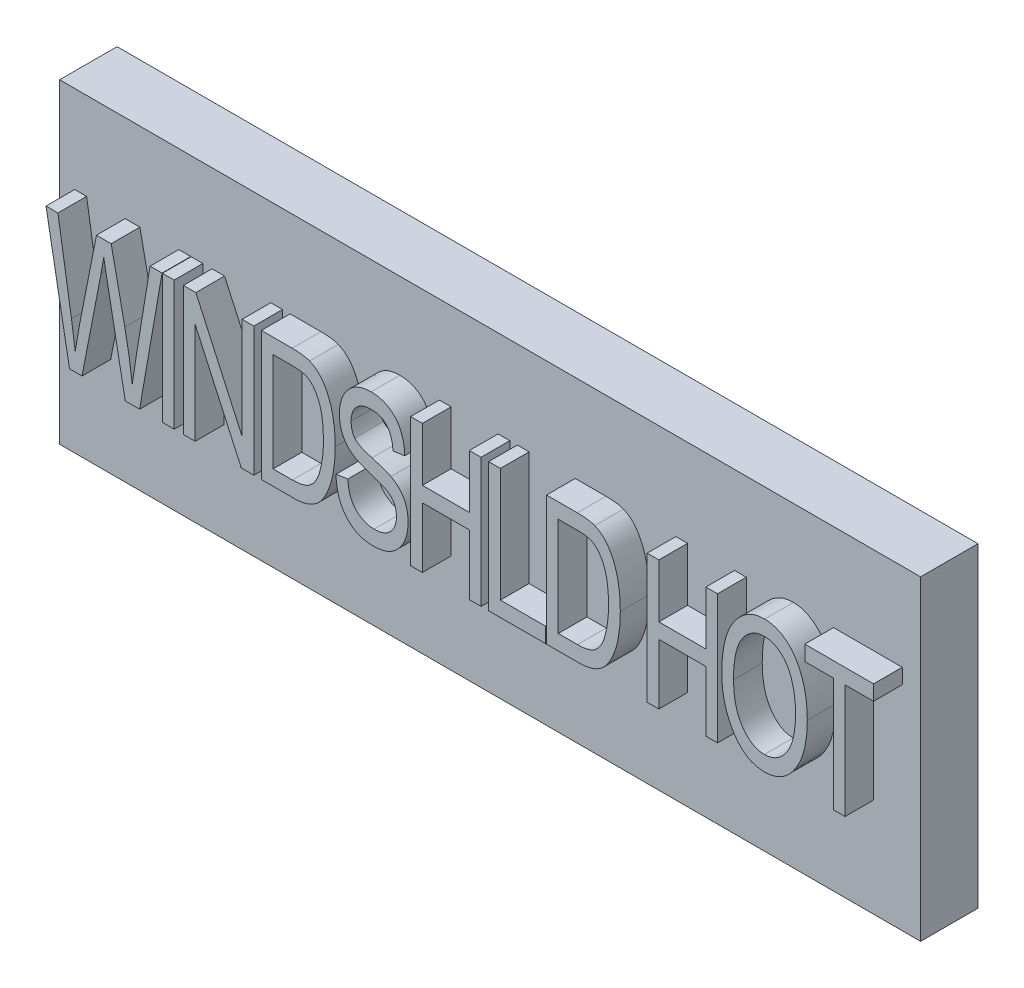
from build123d import *

# Parameters (mm, degrees)
SKETCH1_W           = 30
SKETCH1_H           = 11
BOSS_EXTRUDE1_DEPTH = 2
SKETCH2_W           = 0.409090909
SKETCH2_H           = 4.5
BOSS_EXTRUDE2_DEPTH = 1


with BuildPart() as part:
    # Sketch1 → Boss-Extrude1 (new body)
    with BuildSketch(Plane.XY):
        with Locations((-36.24, 26.08)):
            Rectangle(SKETCH1_W, SKETCH1_H)
    extrude(amount=BOSS_EXTRUDE1_DEPTH)

    # Sketch2 → Boss-Extrude2 (add)
    # profile 1 of 11: a face of its own
    with BuildSketch(Plane.XY.offset(2)):
        with BuildLine():
            Line((-49.896598041, 24.031303977), (-50.715693009, 28.531303977))
            Line((-50.715693009, 28.531303977), (-50.300210054, 28.531303977))
            Line((-50.300210054, 28.531303977), (-49.829024989, 25.580918425))
            add(Edge.make_bspline(
                [(-49.829024989, 25.580918425), (-49.804767081, 25.428844125), (-49.755939345, 25.122740092), (-49.717083509, 24.815210797), (-49.697531483, 24.660463879)],
                knots=[0, 0, 0, 0, 0.993611861, 2, 2, 2, 2], degree=3))
            Line((-49.697531483, 24.660463879), (-49.555993333, 25.492342938))
            Line((-49.555993333, 25.492342938), (-48.956967359, 28.531303977))
            Line((-48.956967359, 28.531303977), (-48.444690574, 28.531303977))
            Line((-48.444690574, 28.531303977), (-47.969852911, 26.253909496))
            add(Edge.make_bspline(
                [(-47.969852911, 26.253909496), (-47.94211344, 26.11675588), (-47.88736018, 25.84603667), (-47.817541006, 25.443140672), (-47.757254792, 25.049278197), (-47.725969402, 24.789004954), (-47.710518496, 24.660463879)],
                knots=[0, 0, 0, 0, 1.039711671, 2.052223853, 3.038052338, 4, 4, 4, 4], degree=3))
            add(Edge.make_bspline(
                [(-47.710518496, 24.660463879), (-47.700258696, 24.735658678), (-47.679104887, 24.890696442), (-47.644786218, 25.129141947), (-47.604957559, 25.380133749), (-47.576964133, 25.551404869), (-47.562588301, 25.639359983)],
                knots=[0, 0, 0, 0, 0.919846125, 1.896552558, 2.919788924, 4, 4, 4, 4], degree=3))
            Line((-47.562588301, 25.639359983), (-47.088663788, 28.531303977))
            Line((-47.088663788, 28.531303977), (-46.671354535, 28.531303977))
            Line((-46.671354535, 28.531303977), (-47.453923528, 24.031303977))
            Line((-47.453923528, 24.031303977), (-47.953416223, 24.031303977))
            Line((-47.953416223, 24.031303977), (-48.606318009, 27.460179788))
            Line((-48.606318009, 27.460179788), (-48.704024989, 27.987980113))
            add(Edge.make_bspline(
                [(-48.704024989, 27.987980113), (-48.711693768, 27.940202492), (-48.726642648, 27.847068761), (-48.747475377, 27.710966286), (-48.772136661, 27.583134694), (-48.787756909, 27.500362454), (-48.795339924, 27.460179788)],
                knots=[0, 0, 0, 0, 1.083992152, 2.113044358, 3.083957297, 4, 4, 4, 4], degree=3))
            Line((-48.795339924, 27.460179788), (-49.460112652, 24.031303977))
            Line((-49.460112652, 24.031303977), (-49.896598041, 24.031303977))
        make_face()
    # profile 2 of 11: a face of its own
    with BuildSketch(Plane.XY.offset(2)):
        with Locations((-46.45402499, 26.281303977)):
            Rectangle(SKETCH2_W, SKETCH2_H)
    # profile 3 of 11: a face of its own
    with BuildSketch(Plane.XY.offset(2)):
        Polygon((-45.928050963, 24.031303977), (-45.928050963, 28.531303977), (-45.493391872, 28.531303977), (-43.882596418, 24.993763392), (-43.882596418, 28.531303977), (-43.473505509, 28.531303977), (-43.473505509, 24.031303977), (-43.910904048, 24.031303977), (-45.518960054, 27.562452516), (-45.518960054, 24.031303977), align=None)
    # profile 4 of 11: a face of its own
    with BuildSketch(Plane.XY.offset(2)):
        with BuildLine():
            Line((-43.210518496, 24.031303977), (-43.210518496, 28.531303977))
            Line((-43.210518496, 28.531303977), (-42.136654859, 28.531303977))
            add(Edge.make_bspline(
                [(-42.136654859, 28.531303977), (-42.074205078, 28.530362561), (-41.957004054, 28.528595782), (-41.793498743, 28.513015071), (-41.652567811, 28.489917782), (-41.569623311, 28.461403645), (-41.53123684, 28.448207386)],
                knots=[0, 0, 0, 0, 1.219669898, 2.288984163, 3.208146887, 4, 4, 4, 4], degree=3))
            add(Edge.make_bspline(
                [(-41.53123684, 28.448207386), (-41.486580825, 28.428077034), (-41.396464411, 28.387453724), (-41.273797188, 28.297467645), (-41.160101204, 28.1869887), (-41.055977009, 28.054323629), (-40.96254365, 27.901348816), (-40.879497576, 27.729634519), (-40.807596459, 27.539478868), (-40.746335898, 27.33079679), (-40.698711548, 27.10266434), (-40.662632986, 26.85514002), (-40.643550734, 26.587206105), (-40.640611099, 26.401866719), (-40.639089924, 26.305959009)],
                knots=[0, 0, 0, 0, 0.718916769, 1.450783304, 2.223456072, 3.045856778, 3.924437181, 4.85566402, 5.847772004, 6.91187302, 8.051816815, 9.273363808, 10.58904554, 12, 12, 12, 12], degree=3))
            add(Edge.make_bspline(
                [(-40.639089924, 26.305959009), (-40.639510922, 26.243547352), (-40.640339015, 26.120784798), (-40.64995581, 25.940505981), (-40.664106239, 25.767132613), (-40.685147964, 25.60143957), (-40.711719816, 25.442745637), (-40.743250072, 25.29113855), (-40.781547772, 25.146614392), (-40.826113787, 25.010158306), (-40.875680793, 24.882486895), (-40.92738344, 24.763315503), (-40.982734128, 24.654062578), (-41.041447792, 24.554502366), (-41.103602978, 24.464690045), (-41.169113172, 24.383941829), (-41.238647369, 24.313429495), (-41.311689113, 24.252199309), (-41.389147903, 24.199666355), (-41.472166415, 24.154746477), (-41.560696253, 24.116292713), (-41.655314505, 24.085562292), (-41.755021609, 24.060667923), (-41.860687932, 24.043463753), (-41.972095903, 24.033541382), (-42.048363588, 24.032060745), (-42.087344794, 24.031303977)],
                knots=[0, 0, 0, 0, 1.474719925, 2.900746318, 4.265083331, 5.584618838, 6.846367742, 8.066655144, 9.242614792, 10.377671559, 11.45700295, 12.478026917, 13.446305371, 14.349304424, 15.207292232, 16.025144495, 16.803351072, 17.543809457, 18.273994926, 19.011091712, 19.771407638, 20.551606215, 21.359337178, 22.197744366, 23.078848397, 24, 24, 24, 24], degree=3))
            Line((-42.087344794, 24.031303977), (-43.210518496, 24.031303977))
        make_face()
        with BuildLine():
            Line((-42.801427587, 24.557278003), (-42.132089113, 24.557278003))
            add(Edge.make_bspline(
                [(-42.132089113, 24.557278003), (-42.099504003, 24.557835613), (-42.036076771, 24.558921006), (-41.944028877, 24.566382611), (-41.8575523, 24.577704309), (-41.777836625, 24.595452227), (-41.703360723, 24.615678396), (-41.636328077, 24.64366629), (-41.574048324, 24.674433154), (-41.517860104, 24.711487253), (-41.466347602, 24.753936663), (-41.418394892, 24.801996252), (-41.37358422, 24.856177752), (-41.331994344, 24.916187772), (-41.293205059, 24.981788478), (-41.25777155, 25.053290294), (-41.224726916, 25.130605455), (-41.206392879, 25.185081798), (-41.197024177, 25.212919236)],
                knots=[0, 0, 0, 0, 1.25371961, 2.440377379, 3.551822103, 4.606263674, 5.58121131, 6.516445046, 7.396435544, 8.250798952, 9.099604811, 9.960924454, 10.859197814, 11.801445901, 12.76763042, 13.789029869, 14.870193163, 16, 16, 16, 16], degree=3))
            add(Edge.make_bspline(
                [(-41.197024177, 25.212919236), (-41.185068319, 25.252075966), (-41.160757037, 25.331698042), (-41.131033124, 25.455233847), (-41.1054507, 25.584090958), (-41.084448058, 25.718744836), (-41.068255036, 25.859184931), (-41.05611831, 26.005347733), (-41.050207281, 26.157067271), (-41.048864099, 26.259993389), (-41.048180833, 26.312351055)],
                knots=[0, 0, 0, 0, 0.882022626, 1.793522438, 2.736362818, 3.712227637, 4.729149773, 5.782006442, 6.871724996, 8, 8, 8, 8], degree=3))
            add(Edge.make_bspline(
                [(-41.048180833, 26.312351055), (-41.048738383, 26.368062115), (-41.049823507, 26.476489114), (-41.057302585, 26.634541021), (-41.068662578, 26.783250219), (-41.08590589, 26.922843064), (-41.108931207, 27.05280939), (-41.135019055, 27.174326847), (-41.166459718, 27.286486111), (-41.204443261, 27.389224382), (-41.245487214, 27.483349013), (-41.289143714, 27.569512869), (-41.336040914, 27.647469675), (-41.384660561, 27.718039622), (-41.437519376, 27.779563367), (-41.491819008, 27.834248994), (-41.550778146, 27.879051319), (-41.592184157, 27.903728979), (-41.612507132, 27.915841314)],
                knots=[0, 0, 0, 0, 1.507991626, 2.934911033, 4.282178896, 5.544296343, 6.740383917, 7.853907269, 8.907569681, 9.890257626, 10.816361983, 11.685987123, 12.502715924, 13.277602986, 14.002379069, 14.695703953, 15.359822983, 16, 16, 16, 16], degree=3))
            add(Edge.make_bspline(
                [(-41.612507132, 27.915841314), (-41.62728906, 27.923151593), (-41.658309769, 27.938492624), (-41.709635079, 27.956113341), (-41.766927602, 27.971832525), (-41.83037832, 27.984541861), (-41.900039359, 27.992898208), (-41.975469168, 28.000959055), (-42.057193058, 28.003786913), (-42.113827244, 28.00480479), (-42.143046905, 28.005329951)],
                knots=[0, 0, 0, 0, 0.728498321, 1.52879474, 2.394016529, 3.354764453, 4.386422188, 5.495253961, 6.707709339, 8, 8, 8, 8], degree=3))
            Line((-42.143046905, 28.005329951), (-42.801427587, 28.005329951))
            Line((-42.801427587, 28.005329951), (-42.801427587, 24.557278003))
        make_face(mode=Mode.SUBTRACT)
    # profile 5 of 11: a face of its own
    with BuildSketch(Plane.XY.offset(2)):
        with BuildLine():
            Line((-40.609869145, 25.492342938), (-40.200778236, 25.550784496))
            add(Edge.make_bspline(
                [(-40.200778236, 25.550784496), (-40.195152727, 25.491283353), (-40.1845011, 25.378620845), (-40.153061448, 25.221084818), (-40.113828766, 25.083583956), (-40.063435278, 24.965041472), (-40.000396094, 24.862947549), (-39.926770893, 24.772932043), (-39.841831349, 24.692330007), (-39.745445885, 24.623422509), (-39.639721726, 24.567289474), (-39.525998134, 24.528122194), (-39.406174921, 24.503504517), (-39.32397096, 24.500410509), (-39.282149989, 24.498836444)],
                knots=[0, 0, 0, 0, 1.378667787, 2.610440104, 3.701931089, 4.674248918, 5.573131256, 6.461908199, 7.35149003, 8.26782908, 9.18860121, 10.10402411, 11.035429035, 12, 12, 12, 12], degree=3))
            add(Edge.make_bspline(
                [(-39.282149989, 24.498836444), (-39.252288372, 24.499564776), (-39.193914891, 24.50098852), (-39.109030716, 24.511278672), (-39.028982979, 24.527097699), (-38.955033806, 24.551486292), (-38.88512826, 24.58020844), (-38.82175404, 24.618199823), (-38.76225115, 24.661362376), (-38.708598679, 24.711380431), (-38.661547252, 24.767555916), (-38.618726055, 24.826691565), (-38.584237763, 24.891159846), (-38.556096945, 24.959211225), (-38.532447148, 25.030709314), (-38.517961001, 25.106865084), (-38.506880161, 25.186723686), (-38.506280261, 25.241488462), (-38.505973041, 25.269534496)],
                knots=[0, 0, 0, 0, 1.158662483, 2.26495304, 3.314472415, 4.319432228, 5.282701208, 6.241031805, 7.179051494, 8.131905663, 9.078809715, 10.019503523, 10.960419831, 11.908207739, 12.875813187, 13.876668124, 14.912603297, 16, 16, 16, 16], degree=3))
            add(Edge.make_bspline(
                [(-38.505973041, 25.269534496), (-38.506807935, 25.301847403), (-38.508430613, 25.364649886), (-38.522243912, 25.456053178), (-38.545800601, 25.541027199), (-38.578936048, 25.619643852), (-38.621355295, 25.691448181), (-38.67264412, 25.757227511), (-38.734950058, 25.814678045), (-38.794207699, 25.858496683), (-38.851441675, 25.890719987), (-38.905245633, 25.918087141), (-38.970265816, 25.947051558), (-39.046131284, 25.978004325), (-39.132704001, 26.010609734), (-39.23019856, 26.045383686), (-39.33845499, 26.08285827), (-39.414815891, 26.107636389), (-39.454735216, 26.120589691)],
                knots=[0, 0, 0, 0, 1.110320368, 2.157988364, 3.168367217, 4.134207044, 5.08167985, 6.027822949, 6.990085685, 7.986279249, 8.5534133, 9.245955837, 10.06080126, 10.99927657, 12.062245857, 13.240447039, 14.557383531, 16, 16, 16, 16], degree=3))
            add(Edge.make_bspline(
                [(-39.454735216, 26.120589691), (-39.490406434, 26.132598419), (-39.559573382, 26.155883496), (-39.65885698, 26.192351912), (-39.750514865, 26.228508317), (-39.833495088, 26.266096263), (-39.908971178, 26.303442506), (-39.976335076, 26.341574594), (-40.036040003, 26.380073385), (-40.10557788, 26.430848911), (-40.181710883, 26.501558316), (-40.26143854, 26.596411136), (-40.331300755, 26.700995022), (-40.389668153, 26.815623587), (-40.436666931, 26.939157159), (-40.468923299, 27.071686097), (-40.489781959, 27.211748642), (-40.491903272, 27.307910939), (-40.492986028, 27.356993912)],
                knots=[0, 0, 0, 0, 1.0264311, 1.990263046, 2.884328381, 3.712868478, 4.473911347, 5.180244425, 5.822662008, 6.41040724, 7.526662438, 8.645876896, 9.78323057, 10.948978704, 12.146941123, 13.379101456, 14.662246066, 16, 16, 16, 16], degree=3))
            add(Edge.make_bspline(
                [(-40.492986028, 27.356993912), (-40.49225579, 27.401179849), (-40.490821326, 27.487977704), (-40.475225845, 27.614832531), (-40.45334117, 27.736074548), (-40.419975852, 27.850532796), (-40.378308349, 27.959126529), (-40.325643705, 28.060473962), (-40.26516562, 28.156592152), (-40.195042178, 28.24559057), (-40.117381912, 28.326472164), (-40.032204448, 28.396965354), (-39.940394575, 28.456290555), (-39.842505143, 28.506261597), (-39.737412255, 28.543628618), (-39.625912285, 28.569829135), (-39.508215047, 28.586788299), (-39.427400071, 28.588747771), (-39.386249015, 28.589745535)],
                knots=[0, 0, 0, 0, 1.136904952, 2.233310384, 3.286059003, 4.305380353, 5.297811281, 6.275594128, 7.240799044, 8.217419416, 9.187225634, 10.122314966, 11.056911671, 11.996096186, 12.945425202, 13.920440971, 14.941086741, 16, 16, 16, 16], degree=3))
            add(Edge.make_bspline(
                [(-39.386249015, 28.589745535), (-39.32980691, 28.58788208), (-39.219427683, 28.584237872), (-39.05934751, 28.553832409), (-38.910565523, 28.502193259), (-38.773446599, 28.430679505), (-38.649556114, 28.339351115), (-38.538860854, 28.230984943), (-38.443964521, 28.103868922), (-38.364847568, 27.959816316), (-38.301266807, 27.800553857), (-38.253693679, 27.627586432), (-38.223476101, 27.441085368), (-38.217066922, 27.312057892), (-38.213765249, 27.245589691)],
                knots=[0, 0, 0, 0, 1.013423389, 1.98186956, 2.914003298, 3.833670994, 4.749118402, 5.66941991, 6.606688264, 7.588214989, 8.613810395, 9.680452583, 10.805090591, 12, 12, 12, 12], degree=3))
            Line((-38.213765249, 27.245589691), (-38.622856158, 27.187148133))
            add(Edge.make_bspline(
                [(-38.622856158, 27.187148133), (-38.625753879, 27.223113832), (-38.631397302, 27.293158402), (-38.647035543, 27.394068362), (-38.667267936, 27.487936007), (-38.691093615, 27.574712416), (-38.721959031, 27.653768423), (-38.755771647, 27.726309103), (-38.796807641, 27.790640947), (-38.841247862, 27.848613775), (-38.891173044, 27.899205683), (-38.945465991, 27.943608812), (-39.004895945, 27.981172696), (-39.069506139, 28.01120537), (-39.138230916, 28.035313698), (-39.212151599, 28.051394245), (-39.290691432, 28.06161626), (-39.344819757, 28.06304137), (-39.372551775, 28.063771509)],
                knots=[0, 0, 0, 0, 1.332781651, 2.595643015, 3.76911355, 4.879794975, 5.915709819, 6.901580768, 7.831401361, 8.728970371, 9.595788347, 10.451150076, 11.315410954, 12.185723591, 13.07841812, 14.000590235, 14.97562569, 16, 16, 16, 16], degree=3))
            add(Edge.make_bspline(
                [(-39.372551775, 28.063771509), (-39.400581625, 28.063340293), (-39.455278314, 28.062498829), (-39.534733789, 28.053227514), (-39.609141607, 28.038024892), (-39.678058347, 28.015659002), (-39.742398842, 27.988671877), (-39.801323548, 27.954647887), (-39.854816243, 27.913949498), (-39.902945962, 27.867423487), (-39.945633062, 27.816503204), (-39.982866465, 27.761845401), (-40.013781124, 27.703230053), (-40.039251161, 27.641092293), (-40.059635707, 27.575441634), (-40.07414468, 27.506378661), (-40.082400699, 27.433291988), (-40.083387841, 27.383496348), (-40.083895119, 27.357907061)],
                knots=[0, 0, 0, 0, 1.184354875, 2.311117979, 3.376017261, 4.389214773, 5.369104592, 6.320275003, 7.256976433, 8.203348431, 9.144018019, 10.061162688, 10.993612804, 11.939809855, 12.896187442, 13.895482904, 14.91851791, 16, 16, 16, 16], degree=3))
            add(Edge.make_bspline(
                [(-40.083895119, 27.357907061), (-40.082945247, 27.312080991), (-40.081150841, 27.225510752), (-40.055901197, 27.104556975), (-40.021033461, 26.997233576), (-39.980881886, 26.938064108), (-39.961533106, 26.90955073)],
                knots=[0, 0, 0, 0, 1.160848131, 2.192963553, 3.129201001, 4, 4, 4, 4], degree=3))
            add(Edge.make_bspline(
                [(-39.961533106, 26.90955073), (-39.949694263, 26.896121232), (-39.924253148, 26.867261875), (-39.87589123, 26.828487786), (-39.817059904, 26.790236646), (-39.747055347, 26.752804636), (-39.665724917, 26.716661524), (-39.573124692, 26.68146709), (-39.46980171, 26.645409129), (-39.396403473, 26.623997366), (-39.357941385, 26.612777191)],
                knots=[0, 0, 0, 0, 0.62970956, 1.353216188, 2.17402592, 3.099950814, 4.146199612, 5.307098907, 6.588868024, 8, 8, 8, 8], degree=3))
            add(Edge.make_bspline(
                [(-39.357941385, 26.612777191), (-39.320168634, 26.601918601), (-39.247230228, 26.580950887), (-39.142476878, 26.54910072), (-39.046501783, 26.518268706), (-38.959689709, 26.487709888), (-38.881142006, 26.459931767), (-38.811695061, 26.432548163), (-38.750989091, 26.406209969), (-38.714098715, 26.387686398), (-38.696821255, 26.379010957)],
                knots=[0, 0, 0, 0, 1.343280388, 2.593846761, 3.742038175, 4.788285348, 5.739323686, 6.589347293, 7.339326429, 8, 8, 8, 8], degree=3))
            add(Edge.make_bspline(
                [(-38.696821255, 26.379010957), (-38.650309155, 26.352303847), (-38.558548129, 26.299614938), (-38.437051547, 26.19885612), (-38.333894576, 26.082177834), (-38.247363454, 25.951768035), (-38.179333187, 25.806924884), (-38.130887214, 25.648348571), (-38.102715891, 25.476298123), (-38.0988653, 25.357302227), (-38.096882132, 25.296015827)],
                knots=[0, 0, 0, 0, 0.984130026, 1.941533096, 2.884368733, 3.836776552, 4.80748203, 5.814064907, 6.874178887, 8, 8, 8, 8], degree=3))
            add(Edge.make_bspline(
                [(-38.096882132, 25.296015827), (-38.098936306, 25.234434742), (-38.102975348, 25.113350294), (-38.131206118, 24.935537905), (-38.181372945, 24.76672261), (-38.248340658, 24.607528702), (-38.331350133, 24.461333737), (-38.431290219, 24.333098185), (-38.543993588, 24.222239341), (-38.671306669, 24.130682915), (-38.813243545, 24.059809758), (-38.968470046, 24.008697406), (-39.137594391, 23.978171143), (-39.254626198, 23.974669518), (-39.315023366, 23.972862418)],
                knots=[0, 0, 0, 0, 1.095789615, 2.15460771, 3.193310892, 4.222493532, 5.222218775, 6.175692186, 7.106493968, 8.026452195, 8.954238779, 9.918604836, 10.925844388, 12, 12, 12, 12], degree=3))
            add(Edge.make_bspline(
                [(-39.315023366, 23.972862418), (-39.362572659, 23.974049163), (-39.455940369, 23.976379452), (-39.592134934, 23.995863752), (-39.721067952, 24.027730666), (-39.842383393, 24.072723411), (-39.956319748, 24.130257113), (-40.062166748, 24.201733758), (-40.161298974, 24.28477961), (-40.25139794, 24.381396446), (-40.333624275, 24.487746446), (-40.405083744, 24.604459426), (-40.465629318, 24.730628613), (-40.515181506, 24.865663573), (-40.556144101, 25.009275649), (-40.584449365, 25.162178395), (-40.604345283, 25.32413101), (-40.607997956, 25.435361747), (-40.609869145, 25.492342938)],
                knots=[0, 0, 0, 0, 1.016086842, 1.995186369, 2.9341785, 3.850348455, 4.755359365, 5.655891447, 6.574829991, 7.513844666, 8.47432416, 9.444103786, 10.4335913, 11.460949464, 12.515618062, 13.622027892, 14.781814408, 16, 16, 16, 16], degree=3))
        make_face()
    # profile 6 of 11: a face of its own
    with BuildSketch(Plane.XY.offset(2)):
        Polygon((-38.009219794, 24.031303977), (-38.009219794, 28.531303977), (-37.600128885, 28.531303977), (-37.600128885, 26.661174107), (-35.963765249, 26.661174107), (-35.963765249, 28.531303977), (-35.55467434, 28.531303977), (-35.55467434, 24.031303977), (-35.963765249, 24.031303977), (-35.963765249, 26.135200081), (-37.600128885, 26.135200081), (-37.600128885, 24.031303977), align=None)
    # profile 7 of 11: a face of its own
    with BuildSketch(Plane.XY.offset(2)):
        Polygon((-35.291687327, 24.031303977), (-35.291687327, 28.531303977), (-34.882596418, 28.531303977), (-34.882596418, 24.557278003), (-33.30467434, 24.557278003), (-33.30467434, 24.031303977), align=None)
    # profile 8 of 11: a face of its own
    with BuildSketch(Plane.XY.offset(2)):
        with BuildLine():
            Line((-33.275453561, 24.031303977), (-33.275453561, 28.531303977))
            Line((-33.275453561, 28.531303977), (-32.201589924, 28.531303977))
            add(Edge.make_bspline(
                [(-32.201589924, 28.531303977), (-32.139140143, 28.530362561), (-32.021939118, 28.528595782), (-31.858433807, 28.513015071), (-31.717502876, 28.489917782), (-31.634558376, 28.461403645), (-31.596171905, 28.448207386)],
                knots=[0, 0, 0, 0, 1.219669898, 2.288984163, 3.208146887, 4, 4, 4, 4], degree=3))
            add(Edge.make_bspline(
                [(-31.596171905, 28.448207386), (-31.55151589, 28.428077034), (-31.461399476, 28.387453724), (-31.338732252, 28.297467645), (-31.225036269, 28.1869887), (-31.120912074, 28.054323629), (-31.027478715, 27.901348816), (-30.944432641, 27.729634519), (-30.872531524, 27.539478868), (-30.811270962, 27.33079679), (-30.763646613, 27.10266434), (-30.727568051, 26.85514002), (-30.708485799, 26.587206105), (-30.705546164, 26.401866719), (-30.704024989, 26.305959009)],
                knots=[0, 0, 0, 0, 0.718916769, 1.450783304, 2.223456072, 3.045856778, 3.924437181, 4.85566402, 5.847772004, 6.91187302, 8.051816815, 9.273363808, 10.58904554, 12, 12, 12, 12], degree=3))
            add(Edge.make_bspline(
                [(-30.704024989, 26.305959009), (-30.704445986, 26.243547352), (-30.70527408, 26.120784798), (-30.714890875, 25.940505981), (-30.729041304, 25.767132613), (-30.750083029, 25.60143957), (-30.776654881, 25.442745637), (-30.808185137, 25.29113855), (-30.846482837, 25.146614392), (-30.891048852, 25.010158306), (-30.940615858, 24.882486895), (-30.992318505, 24.763315503), (-31.047669193, 24.654062578), (-31.106382857, 24.554502366), (-31.168538043, 24.464690045), (-31.234048237, 24.383941829), (-31.303582434, 24.313429495), (-31.376624178, 24.252199309), (-31.454082968, 24.199666355), (-31.53710148, 24.154746477), (-31.625631318, 24.116292713), (-31.72024957, 24.085562292), (-31.819956674, 24.060667923), (-31.925622997, 24.043463753), (-32.037030968, 24.033541382), (-32.113298653, 24.032060745), (-32.152279859, 24.031303977)],
                knots=[0, 0, 0, 0, 1.474719925, 2.900746318, 4.265083331, 5.584618838, 6.846367742, 8.066655144, 9.242614792, 10.377671559, 11.45700295, 12.478026917, 13.446305371, 14.349304424, 15.207292232, 16.025144495, 16.803351072, 17.543809457, 18.273994926, 19.011091712, 19.771407638, 20.551606215, 21.359337178, 22.197744366, 23.078848397, 24, 24, 24, 24], degree=3))
            Line((-32.152279859, 24.031303977), (-33.275453561, 24.031303977))
        make_face()
        with BuildLine():
            Line((-32.866362652, 24.557278003), (-32.197024177, 24.557278003))
            add(Edge.make_bspline(
                [(-32.197024177, 24.557278003), (-32.164439068, 24.557835613), (-32.101011836, 24.558921006), (-32.008963942, 24.566382611), (-31.922487365, 24.577704309), (-31.84277169, 24.595452227), (-31.768295788, 24.615678396), (-31.701263142, 24.64366629), (-31.638983389, 24.674433154), (-31.582795169, 24.711487253), (-31.531282666, 24.753936663), (-31.483329957, 24.801996252), (-31.438519285, 24.856177752), (-31.396929409, 24.916187772), (-31.358140124, 24.981788478), (-31.322706615, 25.053290294), (-31.289661981, 25.130605455), (-31.271327944, 25.185081798), (-31.261959242, 25.212919236)],
                knots=[0, 0, 0, 0, 1.25371961, 2.440377379, 3.551822103, 4.606263674, 5.58121131, 6.516445046, 7.396435544, 8.250798952, 9.099604811, 9.960924454, 10.859197814, 11.801445901, 12.76763042, 13.789029869, 14.870193163, 16, 16, 16, 16], degree=3))
            add(Edge.make_bspline(
                [(-31.261959242, 25.212919236), (-31.250003384, 25.252075966), (-31.225692102, 25.331698042), (-31.195968189, 25.455233847), (-31.170385765, 25.584090958), (-31.149383122, 25.718744836), (-31.133190101, 25.859184931), (-31.121053375, 26.005347733), (-31.115142346, 26.157067271), (-31.113799164, 26.259993389), (-31.113115898, 26.312351055)],
                knots=[0, 0, 0, 0, 0.882022626, 1.793522438, 2.736362818, 3.712227637, 4.729149773, 5.782006442, 6.871724996, 8, 8, 8, 8], degree=3))
            add(Edge.make_bspline(
                [(-31.113115898, 26.312351055), (-31.113673448, 26.368062115), (-31.114758571, 26.476489114), (-31.12223765, 26.634541021), (-31.133597643, 26.783250219), (-31.150840955, 26.922843064), (-31.173866272, 27.05280939), (-31.19995412, 27.174326847), (-31.231394783, 27.286486111), (-31.269378326, 27.389224382), (-31.310422279, 27.483349013), (-31.354078779, 27.569512869), (-31.400975979, 27.647469675), (-31.449595626, 27.718039622), (-31.50245444, 27.779563367), (-31.556754073, 27.834248994), (-31.615713211, 27.879051319), (-31.657119222, 27.903728979), (-31.677442197, 27.915841314)],
                knots=[0, 0, 0, 0, 1.507991626, 2.934911033, 4.282178896, 5.544296343, 6.740383917, 7.853907269, 8.907569681, 9.890257626, 10.816361983, 11.685987123, 12.502715924, 13.277602986, 14.002379069, 14.695703953, 15.359822983, 16, 16, 16, 16], degree=3))
            add(Edge.make_bspline(
                [(-31.677442197, 27.915841314), (-31.692224125, 27.923151593), (-31.723244834, 27.938492624), (-31.774570144, 27.956113341), (-31.831862667, 27.971832525), (-31.895313385, 27.984541861), (-31.964974423, 27.992898208), (-32.040404233, 28.000959055), (-32.122128123, 28.003786913), (-32.178762309, 28.00480479), (-32.20798197, 28.005329951)],
                knots=[0, 0, 0, 0, 0.728498321, 1.52879474, 2.394016529, 3.354764453, 4.386422188, 5.495253961, 6.707709339, 8, 8, 8, 8], degree=3))
            Line((-32.20798197, 28.005329951), (-32.866362652, 28.005329951))
            Line((-32.866362652, 28.005329951), (-32.866362652, 24.557278003))
        make_face(mode=Mode.SUBTRACT)
    # profile 9 of 11: a face of its own
    with BuildSketch(Plane.XY.offset(2)):
        Polygon((-29.768960054, 24.031303977), (-29.768960054, 28.531303977), (-29.359869145, 28.531303977), (-29.359869145, 26.661174107), (-27.723505509, 26.661174107), (-27.723505509, 28.531303977), (-27.3144146, 28.531303977), (-27.3144146, 24.031303977), (-27.723505509, 24.031303977), (-27.723505509, 26.135200081), (-29.359869145, 26.135200081), (-29.359869145, 24.031303977), align=None)
    # profile 10 of 11: a face of its own
    with BuildSketch(Plane.XY.offset(2)):
        with BuildLine():
            add(Edge.make_bspline(
                [(-27.168310703, 26.221949269), (-27.167208449, 26.31421367), (-27.165062987, 26.4937999), (-27.14490741, 26.754842084), (-27.11125032, 26.999383033), (-27.065382942, 27.227559579), (-27.005050705, 27.439098938), (-26.932385316, 27.634682298), (-26.845691941, 27.813894896), (-26.744962924, 27.975400885), (-26.635209578, 28.119521491), (-26.517446388, 28.244704518), (-26.394313559, 28.351890635), (-26.263003807, 28.438550644), (-26.125850261, 28.507015133), (-25.981224149, 28.554400454), (-25.830637307, 28.585184052), (-25.727513369, 28.588212513), (-25.675311515, 28.589745535)],
                knots=[0, 0, 0, 0, 1.421719368, 2.767277697, 4.031714438, 5.22399474, 6.350951523, 7.418260778, 8.435762613, 9.413326843, 10.346861393, 11.22294111, 12.057880264, 12.856710301, 13.641310108, 14.412672979, 15.19648712, 16, 16, 16, 16], degree=3))
            add(Edge.make_bspline(
                [(-25.675311515, 28.589745535), (-25.641178423, 28.588826891), (-25.573586959, 28.587007761), (-25.473710825, 28.573735661), (-25.37608293, 28.552989992), (-25.280981201, 28.522288774), (-25.18744054, 28.484303001), (-25.096865107, 28.436038905), (-25.008127994, 28.380495394), (-24.922263915, 28.316105332), (-24.83899299, 28.244632991), (-24.761630342, 28.163257167), (-24.687112806, 28.075665761), (-24.617983633, 27.979498989), (-24.553021655, 27.875650144), (-24.491726413, 27.764660101), (-24.436303467, 27.64499133), (-24.384280206, 27.518734448), (-24.337668828, 27.385303878), (-24.297483123, 27.245358446), (-24.264141212, 27.098914365), (-24.235352777, 26.946743648), (-24.214891573, 26.787821899), (-24.1996301, 26.623045734), (-24.188790283, 26.451901544), (-24.188128121, 26.335805903), (-24.187791223, 26.27673823)],
                knots=[0, 0, 0, 0, 0.804712004, 1.593516995, 2.37206623, 3.155234018, 3.947005248, 4.749665883, 5.572140455, 6.413381119, 7.278355676, 8.156541679, 9.058117652, 9.988491903, 10.946396101, 11.945449164, 12.976179309, 14.054519758, 15.164572128, 16.30728275, 17.48603501, 18.705201523, 19.957883438, 21.262779284, 22.60734428, 24, 24, 24, 24], degree=3))
            add(Edge.make_bspline(
                [(-24.187791223, 26.27673823), (-24.189143605, 26.196049696), (-24.191790312, 26.03813646), (-24.208791839, 25.806940212), (-24.239019315, 25.587110972), (-24.280655437, 25.378686875), (-24.334402919, 25.181768745), (-24.400221639, 24.996323213), (-24.478160074, 24.822309034), (-24.540578536, 24.71386346), (-24.57131395, 24.660463879)],
                knots=[0, 0, 0, 0, 1.151368364, 2.253310295, 3.305503057, 4.315722185, 5.284047671, 6.215454068, 7.121273462, 8, 8, 8, 8], degree=3))
            add(Edge.make_bspline(
                [(-24.57131395, 24.660463879), (-24.606705195, 24.606073705), (-24.675345854, 24.500584979), (-24.794166839, 24.360167119), (-24.920301501, 24.240072055), (-25.055578874, 24.142012632), (-25.199608842, 24.066337079), (-25.351639085, 24.011917321), (-25.512286504, 23.979123437), (-25.622196378, 23.974972078), (-25.678050963, 23.972862418)],
                knots=[0, 0, 0, 0, 1.138889074, 2.2088541, 3.222488928, 4.191442471, 5.133698766, 6.070570087, 7.019492036, 8, 8, 8, 8], degree=3))
            add(Edge.make_bspline(
                [(-25.678050963, 23.972862418), (-25.734217537, 23.974908203), (-25.84480639, 23.978936239), (-26.006497055, 24.012717196), (-26.159098236, 24.068965767), (-26.303731409, 24.14684723), (-26.43936232, 24.247290779), (-26.56591213, 24.370141384), (-26.683638695, 24.514905675), (-26.752104024, 24.622868029), (-26.787527424, 24.678726866)],
                knots=[0, 0, 0, 0, 0.975430154, 1.920567584, 2.856122453, 3.793395679, 4.765736862, 5.779613037, 6.851189963, 8, 8, 8, 8], degree=3))
            add(Edge.make_bspline(
                [(-26.787527424, 24.678726866), (-26.818296566, 24.733034048), (-26.87997955, 24.841903806), (-26.956155574, 25.015387756), (-27.022107669, 25.196153136), (-27.076086666, 25.385315733), (-27.116702084, 25.582916655), (-27.14719349, 25.788323664), (-27.164264852, 26.00250404), (-27.166946503, 26.147955642), (-27.168310703, 26.221949269)],
                knots=[0, 0, 0, 0, 0.93067218, 1.865721106, 2.822439659, 3.799862666, 4.79733318, 5.829988704, 6.896079498, 8, 8, 8, 8], degree=3))
        make_face()
        with BuildLine():
            add(Edge.make_bspline(
                [(-26.759219794, 26.214644074), (-26.758615458, 26.148549768), (-26.757441171, 26.020121895), (-26.740559547, 25.83340978), (-26.718335266, 25.657407818), (-26.683013062, 25.493157809), (-26.640280533, 25.339592397), (-26.584450116, 25.198820811), (-26.522199144, 25.067663469), (-26.448046048, 24.949522582), (-26.367220993, 24.84409299), (-26.282269834, 24.751927745), (-26.192601257, 24.674022468), (-26.098750182, 24.609809009), (-26.000268091, 24.559751417), (-25.897550465, 24.524896006), (-25.790678313, 24.503072631), (-25.717724898, 24.500260271), (-25.680790411, 24.498836444)],
                knots=[0, 0, 0, 0, 1.410673042, 2.741079367, 4.000290377, 5.195907763, 6.325195239, 7.399332867, 8.425383899, 9.420845789, 10.37106708, 11.258589132, 12.092524217, 12.901887086, 13.680827422, 14.443326787, 15.211895345, 16, 16, 16, 16], degree=3))
            add(Edge.make_bspline(
                [(-25.680790411, 24.498836444), (-25.64325846, 24.500303089), (-25.568821078, 24.503211896), (-25.459615265, 24.52455912), (-25.355129574, 24.560540306), (-25.255923769, 24.611506864), (-25.161314269, 24.676072771), (-25.071157063, 24.754451676), (-24.986194997, 24.847582289), (-24.905865256, 24.954270425), (-24.833070702, 25.075074095), (-24.768462361, 25.208942137), (-24.716626396, 25.357338314), (-24.671233895, 25.517797804), (-24.638424019, 25.692397757), (-24.613741183, 25.879840846), (-24.599138055, 26.080787656), (-24.597648817, 26.219185797), (-24.596882132, 26.29043547)],
                knots=[0, 0, 0, 0, 0.773936067, 1.534952816, 2.28553704, 3.046527886, 3.828471101, 4.643011206, 5.505074185, 6.424305476, 7.393454711, 8.410093163, 9.484591954, 10.631706976, 11.847107358, 13.145397303, 14.53040287, 16, 16, 16, 16], degree=3))
            add(Edge.make_bspline(
                [(-24.596882132, 26.29043547), (-24.598687559, 26.382759059), (-24.602213212, 26.563049294), (-24.633243606, 26.825641248), (-24.681666772, 27.074064976), (-24.732604493, 27.230789175), (-24.757596418, 27.307683847)],
                knots=[0, 0, 0, 0, 1.07038359, 2.090253547, 3.063007966, 4, 4, 4, 4], degree=3))
            add(Edge.make_bspline(
                [(-24.757596418, 27.307683847), (-24.77932542, 27.362816313), (-24.821732977, 27.470415972), (-24.907822496, 27.617986945), (-25.009812604, 27.748064617), (-25.126411897, 27.858944203), (-25.252504888, 27.949951314), (-25.38672868, 28.016338539), (-25.527824087, 28.056455153), (-25.624228958, 28.061327983), (-25.672572067, 28.063771509)],
                knots=[0, 0, 0, 0, 1.123898753, 2.193464782, 3.230575388, 4.252534933, 5.238801364, 6.171885591, 7.08327522, 8, 8, 8, 8], degree=3))
            add(Edge.make_bspline(
                [(-25.672572067, 28.063771509), (-25.711325111, 28.062345569), (-25.78758711, 28.059539466), (-25.899451603, 28.037908634), (-26.005743976, 28.00234397), (-26.106507593, 27.952068632), (-26.202257512, 27.888389783), (-26.293099257, 27.810523102), (-26.376881367, 27.716837531), (-26.456824176, 27.610913886), (-26.529342446, 27.48983325), (-26.591227353, 27.352755627), (-26.642673478, 27.200528943), (-26.68553785, 27.033250239), (-26.719115288, 26.8505034), (-26.741970738, 26.652205033), (-26.757142435, 26.438601912), (-26.758510868, 26.291072674), (-26.759219794, 26.214644074)],
                knots=[0, 0, 0, 0, 0.777406607, 1.52985611, 2.277503781, 3.020645095, 3.783121624, 4.580273154, 5.414911947, 6.300746409, 7.240551566, 8.241137595, 9.313385425, 10.461736883, 11.704310365, 13.039489264, 14.466285788, 16, 16, 16, 16], degree=3))
        make_face(mode=Mode.SUBTRACT)
    # profile 11 of 11: a face of its own
    with BuildSketch(Plane.XY.offset(2)):
        Polygon((-23.281947067, 24.031303977), (-23.281947067, 28.005329951), (-24.275453561, 28.005329951), (-24.275453561, 28.531303977), (-21.879349664, 28.531303977), (-21.879349664, 28.005329951), (-22.872856158, 28.005329951), (-22.872856158, 24.031303977), align=None)
    extrude(amount=BOSS_EXTRUDE2_DEPTH)


solid = part.part
